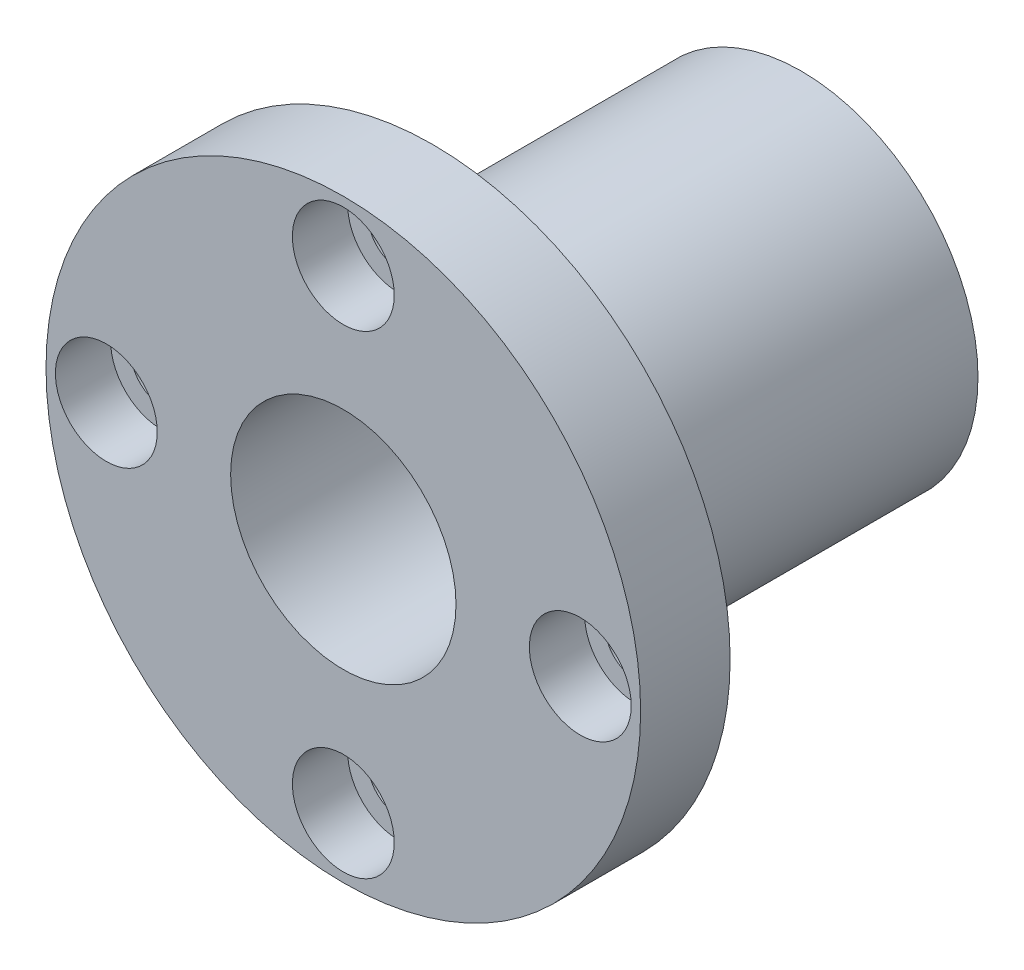
from build123d import *

# Parameters (mm, degrees)
ESBO_O1_R                = 15.995
RESSALTO_EXTRUS_O1_DEPTH = 33.35
ESBO_O2_R                = 26.91
RESSALTO_EXTRUS_O2_DEPTH = 8.1
ESBO_O3_R                = 4.61
CORTE_EXTRUS_O1_DEPTH    = 5
ESBO_O4_R                = 2.755
CORTE_EXTRUS_O2_DEPTH    = 8.1
ESBO_O5_R                = 10.2
CORTE_EXTRUS_O3_DEPTH    = 41.45


with BuildPart() as part:
    # Esboço1 → Ressalto-extrusão1 (new body)
    with BuildSketch(Plane.XY):
        Circle(ESBO_O1_R)
    extrude(amount=RESSALTO_EXTRUS_O1_DEPTH)

    # Esboço2 → Ressalto-extrusão2 (add)
    with BuildSketch(Plane.XY.offset(33.35)):
        Circle(ESBO_O2_R)
    extrude(amount=RESSALTO_EXTRUS_O2_DEPTH)

    # Esboço3 → Corte-extrusão1 (cut)
    with BuildSketch(Plane.XY.offset(41.45)):
        with Locations((21.45, 0)):
            Circle(ESBO_O3_R)
        with Locations((0, -21.45)):
            Circle(ESBO_O3_R)
        with Locations((-21.45, 0)):
            Circle(ESBO_O3_R)
        with Locations((0, 21.45)):
            Circle(ESBO_O3_R)
    extrude(amount=-CORTE_EXTRUS_O1_DEPTH, mode=Mode.SUBTRACT)

    # Esboço4 → Corte-extrusão2 (cut)
    with BuildSketch(Plane.XY.offset(41.45)):
        with Locations((21.45, 0)):
            Circle(ESBO_O4_R)
        with Locations((0, -21.45)):
            Circle(ESBO_O4_R)
        with Locations((-21.45, 0)):
            Circle(ESBO_O4_R)
        with Locations((0, 21.45)):
            Circle(ESBO_O4_R)
    extrude(amount=-CORTE_EXTRUS_O2_DEPTH, mode=Mode.SUBTRACT)

    # Esboço5 → Corte-extrusão3 (cut)
    with BuildSketch(Plane.XY.offset(41.45)):
        Circle(ESBO_O5_R)
    extrude(amount=-CORTE_EXTRUS_O3_DEPTH, mode=Mode.SUBTRACT)


solid = part.part
